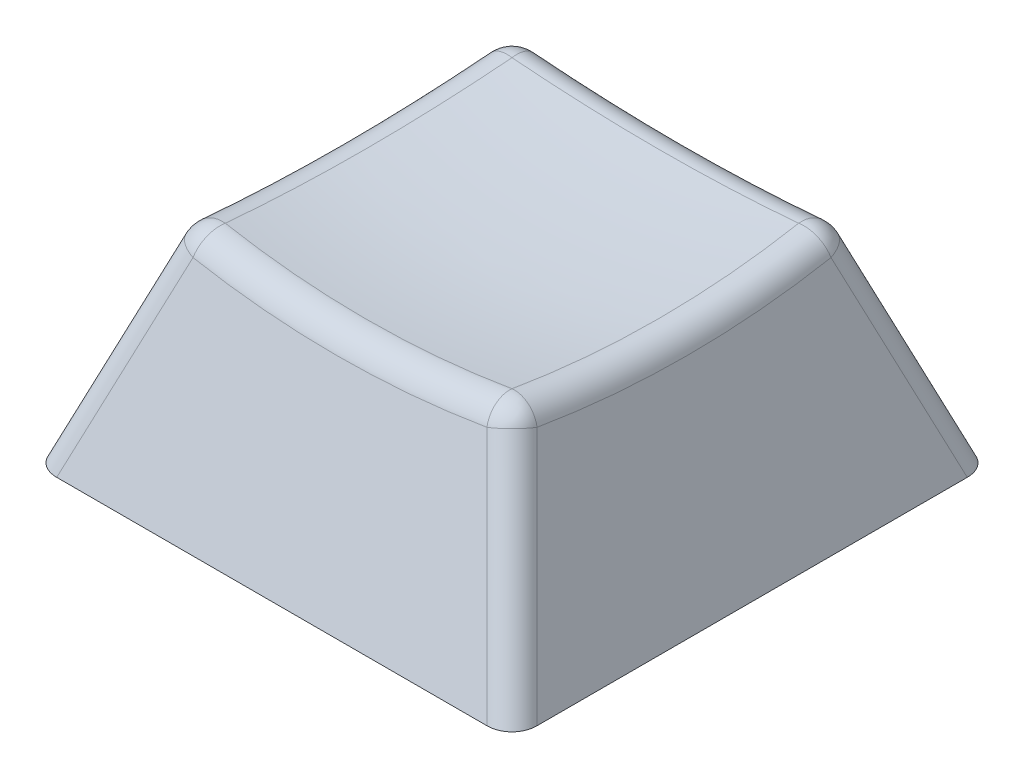
from build123d import *

# Parameters (mm, degrees)
BOSS_EXTRUDE1_DEPTH      = 8
BOSS_EXTRUDE1_TAPER      = 19.700000000000042
FILLET1_R                = 1
SHELL1_T                 = -1.5
BOSS_EXTRUDE2_REACH      = 16.924
BOSS_EXTRUDE2_END_RADIUS = 41.49999999999999
SKETCH4_R                = 2.75
SKETCH4_R_2              = 2
CUT_EXTRUDE2_REACH       = 16.924
CUT_EXTRUDE2_END_RADIUS  = 41.49999999999999
BOSS_EXTRUDE3_START      = -1.43836
SKETCH8_W                = 12.593266454489342
SKETCH8_H                = 12.593266454489337
BOSS_EXTRUDE3_DEPTH      = 1.43836


with BuildPart() as part:
    # Sketch1 → Boss-Extrude1 (new body)
    with BuildSketch(Plane(origin=(0, 0, 0), x_dir=(1, 0, 0), z_dir=(0, 1, 0))):
        Polygon((8.999999999999996, 9.000000000000002), (-9.000000000000004, 8.999999999999998), (-9, -9.000000000000002), (9, -9), align=None)
    extrude(amount=BOSS_EXTRUDE1_DEPTH, taper=BOSS_EXTRUDE1_TAPER)

    # Sketch3 → Cut-Revolve2 (revolve, cut)
    with BuildSketch(Plane(origin=(0, 0, 0), x_dir=(-0.7071067811865476, 0, -0.7071067811865476), z_dir=(0.7071067811865476, 0, -0.7071067811865476))):
        with BuildLine():
            Line((-40, 47.04752471069329), (40, 47.04752471069329))
            ThreePointArc((40, 47.04752471069329), (-7.35e-15, 7.047524710693288), (-40, 47.04752471069329))
        make_face()
    revolve(axis=Axis((28.2842712474619, 47.04752471069329, 28.2842712474619), (-0.7071067811865476, 0, -0.7071067811865476)), mode=Mode.SUBTRACT)

    # Fillet1
    fillet1_edges = [part.edges().sort_by_distance(p)[0] for p in [
        (-3.7925e-13, 7.546443435071887, 6.297982062276191),
        (6.297982062276188, 7.546443435071887, 3.606e-13),
        (-6.297982062276191, 7.5464434350718905, -3.5616e-13),
        (3.7481e-13, 7.546443435071887, -6.297982062276189),
        (7.567792650420588, 4, 7.567792650420591),
        (7.5677926504205875, 4, -7.567792650420591),
        (-7.567792650420594, 4, -7.567792650420589),
        (-7.567792650420591, 4, 7.567792650420593),
    ]]
    fillet(fillet1_edges, radius=FILLET1_R)

    # Shell1
    shell1_openings = [part.faces().sort_by_distance(p)[0] for p in [
        (0, 0, 0),
    ]]
    offset(amount=SHELL1_T, openings=shell1_openings)

    # Boss-Extrude2: up to this sphere (the profile starts outside it)
    boss_extrude2_end = Location((0, 47.04752471069329, 0)) * Sphere(BOSS_EXTRUDE2_END_RADIUS, mode=Mode.PRIVATE)
    # Sketch4 → Boss-Extrude2 (add, up to the surface)
    with BuildSketch(Plane.XZ, mode=Mode.PRIVATE) as boss_extrude2_sk1:
        with Locations(Location((0, 0, 0), (0, 0, 270))):
            Circle(SKETCH4_R)
        Circle(SKETCH4_R_2, mode=Mode.SUBTRACT)
    boss_extrude2_tool1 = extrude(boss_extrude2_sk1.sketch, amount=-BOSS_EXTRUDE2_REACH, mode=Mode.PRIVATE) - boss_extrude2_end
    add(boss_extrude2_tool1.solids().sort_by_distance((0, 0, 2.672218))[0])
    # Sketch4 → Boss-Extrude2 (add, up to the surface)
    with BuildSketch(Plane.XZ, mode=Mode.PRIVATE) as boss_extrude2_sk2:
        Circle(SKETCH4_R_2)
    boss_extrude2_tool2 = extrude(boss_extrude2_sk2.sketch, amount=-BOSS_EXTRUDE2_REACH, mode=Mode.PRIVATE) - boss_extrude2_end
    add(boss_extrude2_tool2.solids().sort_by_distance((0, 0, 0))[0])

    # Cut-Extrude2: up to this sphere (the profile starts outside it)
    cut_extrude2_end = Location((0, 47.04752471069329, 0)) * Sphere(CUT_EXTRUDE2_END_RADIUS, mode=Mode.PRIVATE)
    # Sketch6 → Cut-Extrude2 (cut, up to the surface)
    with BuildSketch(Plane.XZ, mode=Mode.PRIVATE) as cut_extrude2_sk1:
        Polygon((-1.1e-16, -2.05), (-0.5500000000000002, -2.05), (-0.5500000000000002, -0.5500000000000002), (-2.05, -0.5500000000000005), (-2.05, -4.3e-16), (-2.05, 0.5499999999999996), (-0.5500000000000002, 0.5499999999999997), (-0.5500000000000002, 2.0499999999999994), (-1.1e-16, 2.0499999999999994), (0.5500000000000002, 2.0499999999999994), (0.5500000000000002, 0.5499999999999997), (2.05, 0.55), (2.0499999999999994, -2.1e-16), (2.05, -0.55), (0.55, -0.55), (0.5499999999999999, -2.0499999999999994), align=None)
    cut_extrude2_tool1 = extrude(cut_extrude2_sk1.sketch, amount=-CUT_EXTRUDE2_REACH, mode=Mode.PRIVATE) - cut_extrude2_end
    add(cut_extrude2_tool1.solids().sort_by_distance((0, 0, 0))[0], mode=Mode.SUBTRACT)

    # Sketch8 → Boss-Extrude3 (add)
    with BuildSketch(Plane(origin=(0, 4.7625, 0), x_dir=(-1, 0, 0), z_dir=(0, -1, 0)).offset(BOSS_EXTRUDE3_START)):
        Rectangle(SKETCH8_W, SKETCH8_H)
    extrude(amount=BOSS_EXTRUDE3_DEPTH)


solid = part.part
